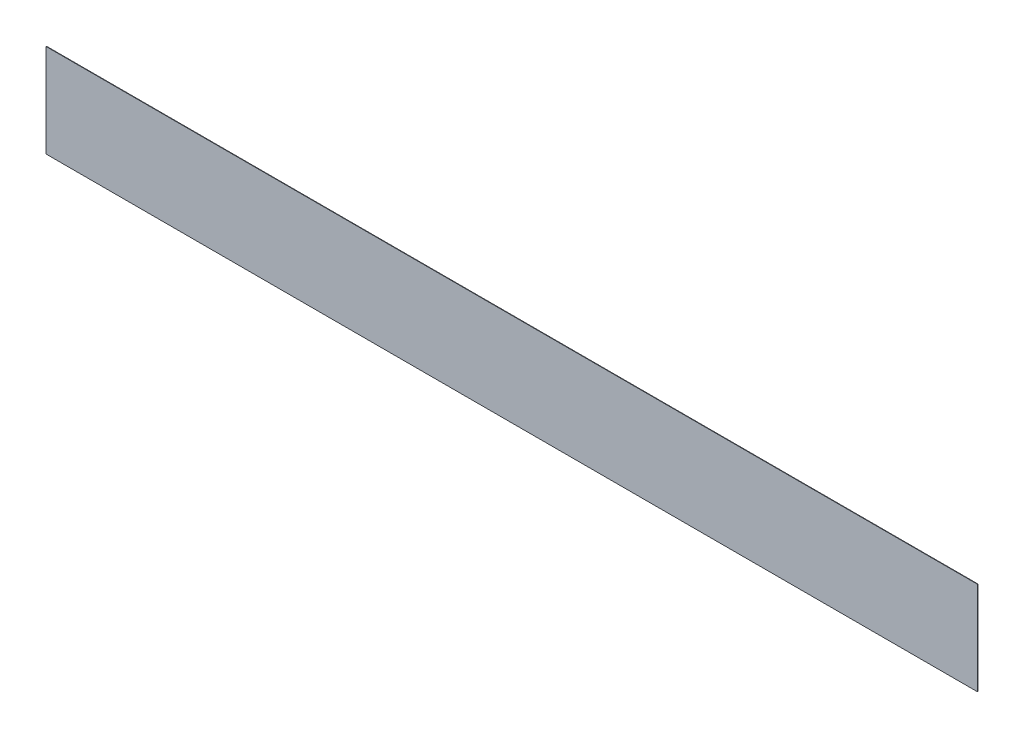
from build123d import *

# Parameters (mm, degrees)
SKETCH1_W           = 40000
SKETCH1_H           = 4000
BOSS_EXTRUDE1_DEPTH = 20


with BuildPart() as part:
    # Sketch1 → Boss-Extrude1 (new body)
    with BuildSketch(Plane.XY):
        with Locations((18000, 0)):
            Rectangle(SKETCH1_W, SKETCH1_H)
    extrude(amount=-BOSS_EXTRUDE1_DEPTH)


solid = part.part
